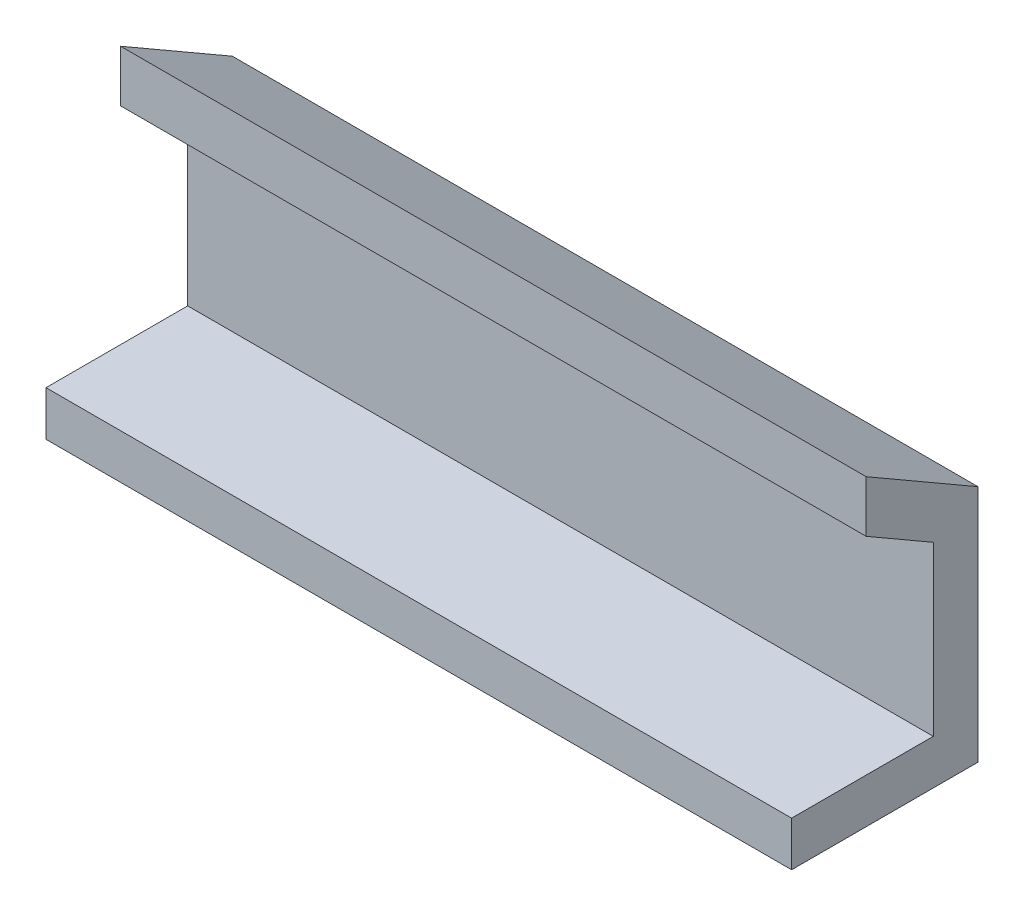
from build123d import *

# Parameters (mm, degrees)
EXTRUDE_1_DEPTH = 100


with BuildPart() as part:
    # Эскиз1 → Бобышка-Вытянуть1 (new body)
    with BuildSketch(Plane(origin=(0, 0, 0), x_dir=(0, 0, -1), z_dir=(1, 0, 0))):
        Polygon((0, 0), (25, 0), (25, 32), (10, 40.660254038), (10, 33.732050808), (19, 28.535898385), (19, 6), (0, 6), align=None)
    extrude(amount=EXTRUDE_1_DEPTH)


solid = part.part
